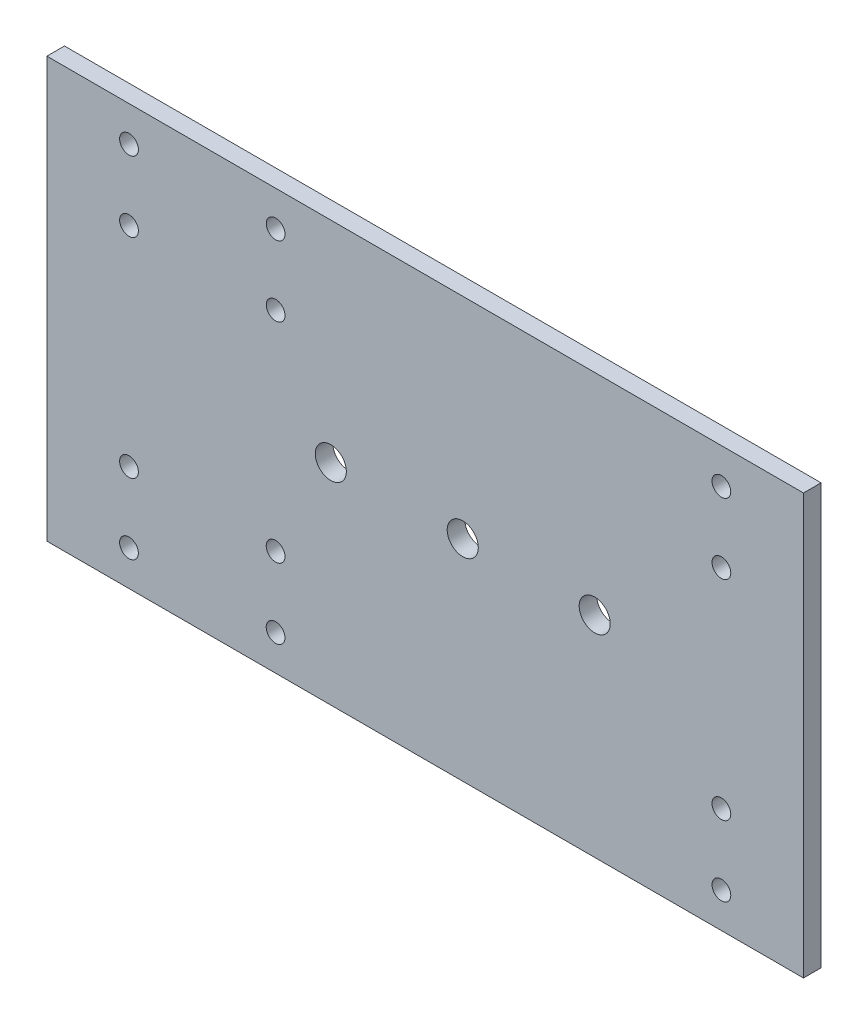
from build123d import *

# Parameters (mm, degrees)
SKETCH_1_W          = 129.003888627
SKETCH_1_H          = 71.620980981
SKETCH_1_R          = 1.6
EXTRUDE_1_DEPTH     = 3
SKETCH_2_R          = 2.65
CUT_EXTRUDE_1_DEPTH = 3
SKETCH_3_R          = 2.65
CUT_EXTRUDE_2_DEPTH = 3


with BuildPart() as part:
    # 草图1 → 凸台-拉伸1 (new body)
    with BuildSketch(Plane.XY):
        with Locations((-64.501944314, -11.78950951)):
            Rectangle(SKETCH_1_W, SKETCH_1_H)
        with Locations((-14, -29.6)):
            Circle(SKETCH_1_R, mode=Mode.SUBTRACT)
        with Locations((-14, -41.6)):
            Circle(SKETCH_1_R, mode=Mode.SUBTRACT)
        with Locations((-14, 6)):
            Circle(SKETCH_1_R, mode=Mode.SUBTRACT)
        with Locations((-14, 18)):
            Circle(SKETCH_1_R, mode=Mode.SUBTRACT)
        with Locations((-90.004518872, 18.016885816)):
            Circle(SKETCH_1_R, mode=Mode.SUBTRACT)
        with Locations((-90.005778933, 6.016885882)):
            Circle(SKETCH_1_R, mode=Mode.SUBTRACT)
        with Locations((-90.010777175, -41.583113855)):
            Circle(SKETCH_1_R, mode=Mode.SUBTRACT)
        with Locations((-90.009517114, -29.583113922)):
            Circle(SKETCH_1_R, mode=Mode.SUBTRACT)
        with Locations((-115.010777037, -41.580488728)):
            Circle(SKETCH_1_R, mode=Mode.SUBTRACT)
        with Locations((-115.009516976, -29.580488794)):
            Circle(SKETCH_1_R, mode=Mode.SUBTRACT)
        with Locations((-115.005778795, 6.019511009)):
            Circle(SKETCH_1_R, mode=Mode.SUBTRACT)
        with Locations((-115.004518734, 18.019510943)):
            Circle(SKETCH_1_R, mode=Mode.SUBTRACT)
    extrude(amount=EXTRUDE_1_DEPTH)

    # 草图2 → 切除-拉伸1 (cut)
    with BuildSketch(Plane.XY.offset(3)):
        with Locations((-58.1, -11.789509509)):
            Circle(SKETCH_2_R)
    extrude(amount=-CUT_EXTRUDE_1_DEPTH, mode=Mode.SUBTRACT)

    # 草图3 → 切除-拉伸2 (cut)
    with BuildSketch(Plane.XY.offset(3)):
        with Locations((-80.6, -11.789509509)):
            Circle(SKETCH_3_R)
        with Locations((-35.6, -11.789509509)):
            Circle(SKETCH_3_R)
    extrude(amount=-CUT_EXTRUDE_2_DEPTH, mode=Mode.SUBTRACT)


solid = part.part
